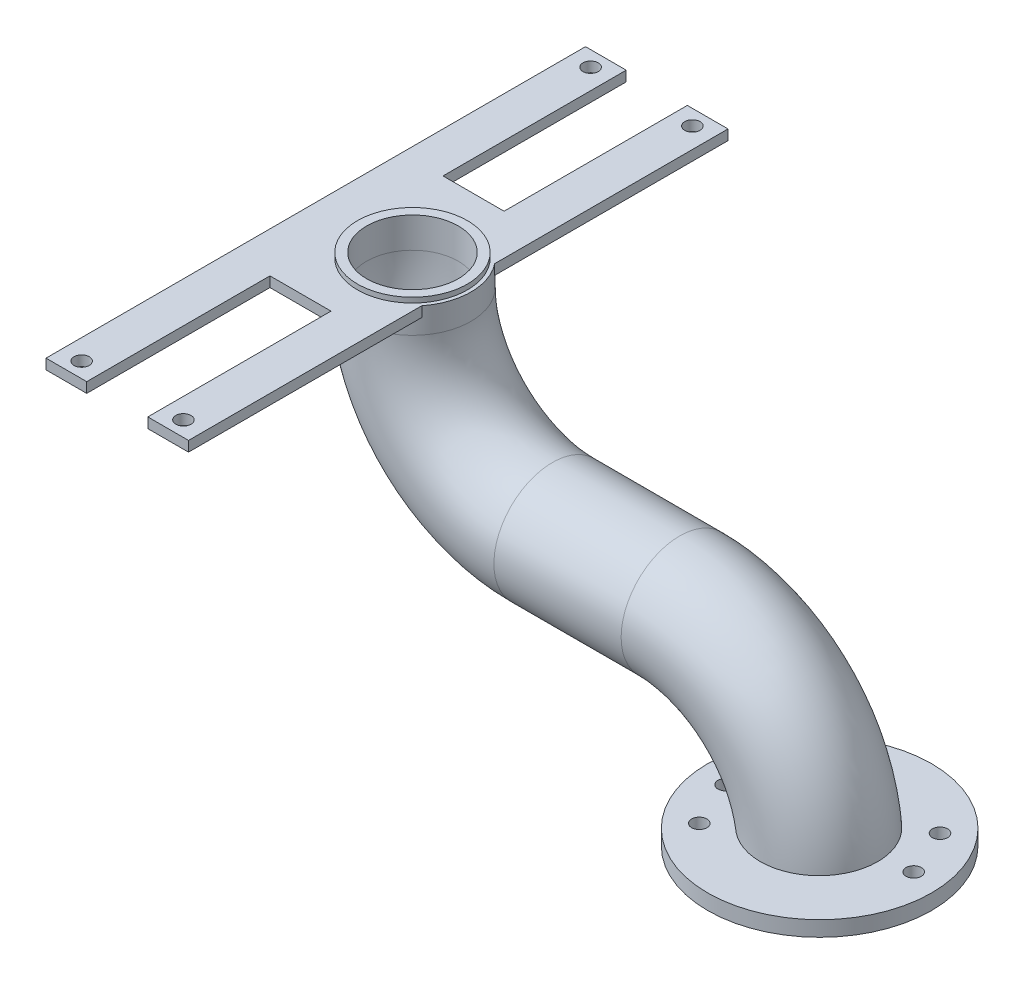
from build123d import *

# Parameters (mm, degrees)
SWEEP_1_PROFILE_R   = 11.5
SWEEP_1_PROFILE_R_2 = 9
SKETCH_3_R          = 22
SKETCH_3_R_2        = 9
EXTRUDE_1_DEPTH     = 3
EXTRUDE_START       = 3
SKETCH_4_R          = 12
SKETCH_4_R_2        = 9
EXTRUDE_2_DEPTH     = 3
SKETCH_7_R          = 1.5
CUT_EXTRUDE_1_DEPTH = 10
SKETCH_8_R          = 11.5
SKETCH_8_R_2        = 9
EXTRUDE_3_DEPTH     = 5
SKETCH_9_R          = 10.8
SKETCH_9_R_2        = 9
EXTRUDE_4_DEPTH     = 1
SKETCH_10_R         = 1.5
EXTRUDE_5_DEPTH     = 2
SKETCH_11_W         = 12
SKETCH_11_H         = 36
CUT_EXTRUDE_2_DEPTH = 10


with BuildPart() as part:
    # 扫描-薄件1: sweep along a path in 草图1
    with BuildLine(Plane.XY) as sweep_1_path:
        ThreePointArc((0, 0), (-8.054563517, 19.445436483), (-27.5, 27.5))
        Line((-27.5, 27.5), (-52.5, 27.5))
        ThreePointArc((-52.5, 27.5), (-71.945436483, 35.554563517), (-80, 55))
    # 扫描-薄件1 profile (on start of the path) → 扫描-薄件1 (sweep)
    with BuildSketch(Plane(origin=(0, 0, 0), x_dir=(1, 0, 0), z_dir=(0, 1, 0))):
        Circle(SWEEP_1_PROFILE_R)
        Circle(SWEEP_1_PROFILE_R_2, mode=Mode.SUBTRACT)
    sweep(path=sweep_1_path.line)

    # 草图3 → 凸台-拉伸1 (add)
    with BuildSketch(Plane.XZ):
        Circle(SKETCH_3_R)
        Circle(SKETCH_3_R_2, mode=Mode.SUBTRACT)
    extrude(amount=-EXTRUDE_1_DEPTH)

    # 草图4 → 凸台-拉伸2 (add)
    with BuildSketch(Plane.XZ.offset(EXTRUDE_START)):
        Circle(SKETCH_4_R)
        Circle(SKETCH_4_R_2, mode=Mode.SUBTRACT)
    extrude(amount=-EXTRUDE_2_DEPTH)

    # 草图7 → 切除-拉伸1 (cut)
    with BuildSketch(Plane.XZ):
        with Locations((-12.664726672, 10.981465686)):
            Circle(SKETCH_7_R)
        with Locations((12.664726672, -10.981465686)):
            Circle(SKETCH_7_R)
        with Locations((-16.663757776, 1.818534314)):
            Circle(SKETCH_7_R)
        with Locations((16.663757776, -1.818534314)):
            Circle(SKETCH_7_R)
    extrude(amount=-CUT_EXTRUDE_1_DEPTH, mode=Mode.SUBTRACT)

    # 草图8 → 凸台-拉伸3 (add)
    with BuildSketch(Plane(origin=(0, 55, 0), x_dir=(1, 0, 0), z_dir=(0, 1, 0))):
        with Locations(Location((-80, 0, 0), (0, 0, 180))):
            Circle(SKETCH_8_R)
        with Locations(Location((-80, 0, 0), (0, 0, 180))):
            Circle(SKETCH_8_R_2, mode=Mode.SUBTRACT)
    extrude(amount=EXTRUDE_3_DEPTH)

    # 草图9 → 凸台-拉伸4 (add)
    with BuildSketch(Plane(origin=(0, 60, 0), x_dir=(1, 0, 0), z_dir=(0, 1, 0))):
        with Locations(Location((-80, 0, 0), (0, 0, 180))):
            Circle(SKETCH_9_R)
        with Locations(Location((-80, 0, 0), (0, 0, 180))):
            Circle(SKETCH_9_R_2, mode=Mode.SUBTRACT)
    extrude(amount=EXTRUDE_4_DEPTH)


with BuildPart() as body_2:
    # 草图10 → 凸台-拉伸5 (new body)
    with BuildSketch(Plane(origin=(0, 60, 0), x_dir=(1, 0, 0), z_dir=(0, 1, 0))):
        with BuildLine():
            Line((-71, 7.158910532), (-71, 53))
            Line((-71, 53), (-99, 53))
            Line((-99, 53), (-99, -53))
            Line((-99, -53), (-71, -53))
            Line((-71, -53), (-71, -7.158910532))
            ThreePointArc((-71, -7.158910532), (-91.5, 0), (-71, 7.158910532))
        make_face()
        with Locations(Location((-95, 50, 0), (0, 0, 180))):
            Circle(SKETCH_10_R, mode=Mode.SUBTRACT)
        with Locations(Location((-75, 50, 0), (0, 0, 180))):
            Circle(SKETCH_10_R, mode=Mode.SUBTRACT)
        with Locations(Location((-95, -50, 0), (0, 0, 180))):
            Circle(SKETCH_10_R, mode=Mode.SUBTRACT)
        with Locations(Location((-75, -50, 0), (0, 0, 180))):
            Circle(SKETCH_10_R, mode=Mode.SUBTRACT)
    extrude(amount=-EXTRUDE_5_DEPTH)

    # 草图11 → 切除-拉伸2 (cut)
    with BuildSketch(Plane(origin=(0, 60, 0), x_dir=(1, 0, 0), z_dir=(0, 1, 0))):
        with Locations((-85, 35)):
            Rectangle(SKETCH_11_W, SKETCH_11_H)
        with Locations((-85, -35)):
            Rectangle(SKETCH_11_W, SKETCH_11_H)
    extrude(amount=-CUT_EXTRUDE_2_DEPTH, mode=Mode.SUBTRACT)


with BuildPart() as part_1:
    add(part.part)

    # Combine 1: union body 2
    add(body_2.part)


solid = part_1.part
